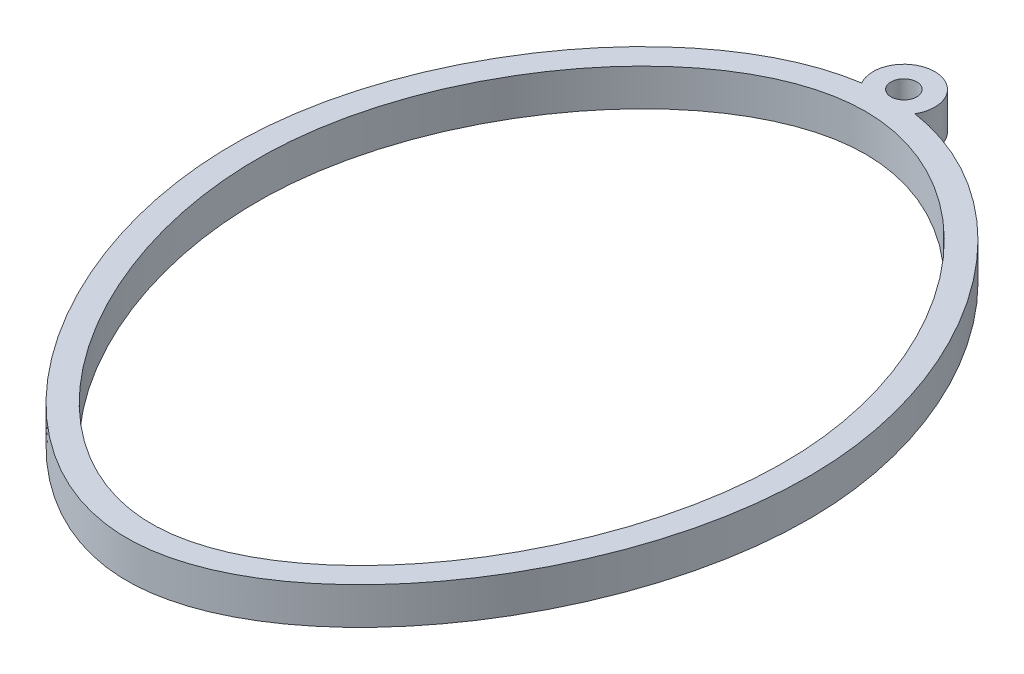
from build123d import *

# Parameters (mm, degrees)
SKETCH1_R           = 1.05
BOSS_EXTRUDE1_DEPTH = 3


with BuildPart() as part:
    # Sketch1 → Boss-Extrude1 (new body)
    # profile 1 of 2: a face of its own
    with BuildSketch(Plane(origin=(0, 0, 0), x_dir=(1, 0, 0), z_dir=(0, 1, 0))):
        with BuildLine():
            add(Edge.make_bspline(
                [(0, 28.05815), (0.719743697, 28.05815), (1.439487395, 28.002120713), (2.156489743, 27.893416041)],
                knots=[0, 0, 0, 0, 0.015109653, 0.015109653, 0.015109653, 0.015109653], degree=3))
            ThreePointArc((2.156489743, 27.893416041), (0, 31.65815), (-2.156489743, 27.893416041))
            add(Edge.make_bspline(
                [(-2.156489743, 27.893416041), (-1.439487395, 28.002120713), (-0.719743697, 28.05815), (0, 28.05815)],
                knots=[0.984890347, 0.984890347, 0.984890347, 0.984890347, 1, 1, 1, 1], degree=3))
        make_face()
        with Locations(Location((0, 29.15815, 0), (0, 0, 270))):
            Circle(SKETCH1_R, mode=Mode.SUBTRACT)
    # profile 2 of 2: a face of its own
    with BuildSketch(Plane(origin=(0, 0, 0), x_dir=(1, 0, 0), z_dir=(0, 1, 0))):
        with BuildLine():
            add(Edge.make_bspline(
                [(0, 28.05815), (11.198414869, 28.05815), (35.015761488, -0.789423133), (0, -51.364430472), (-35.015761488, -0.789423133), (-11.198414869, 28.05815), (0, 28.05815)],
                knots=[0, 0, 0, 0, 0.235089472, 0.5, 0.764910528, 1, 1, 1, 1], degree=3))
        make_face()
        with BuildLine():
            add(Edge.make_bspline(
                [(0, 26.05815), (10.203523677, 26.05815), (32.024589145, -0.848463171), (0, -48.353465233), (-32.024589145, -0.848463171), (-10.203523677, 26.05815), (0, 26.05815)],
                knots=[0, 0, 0, 0, 0.23379985, 0.5, 0.76620015, 1, 1, 1, 1], degree=3))
        make_face(mode=Mode.SUBTRACT)
    extrude(amount=BOSS_EXTRUDE1_DEPTH)


solid = part.part
